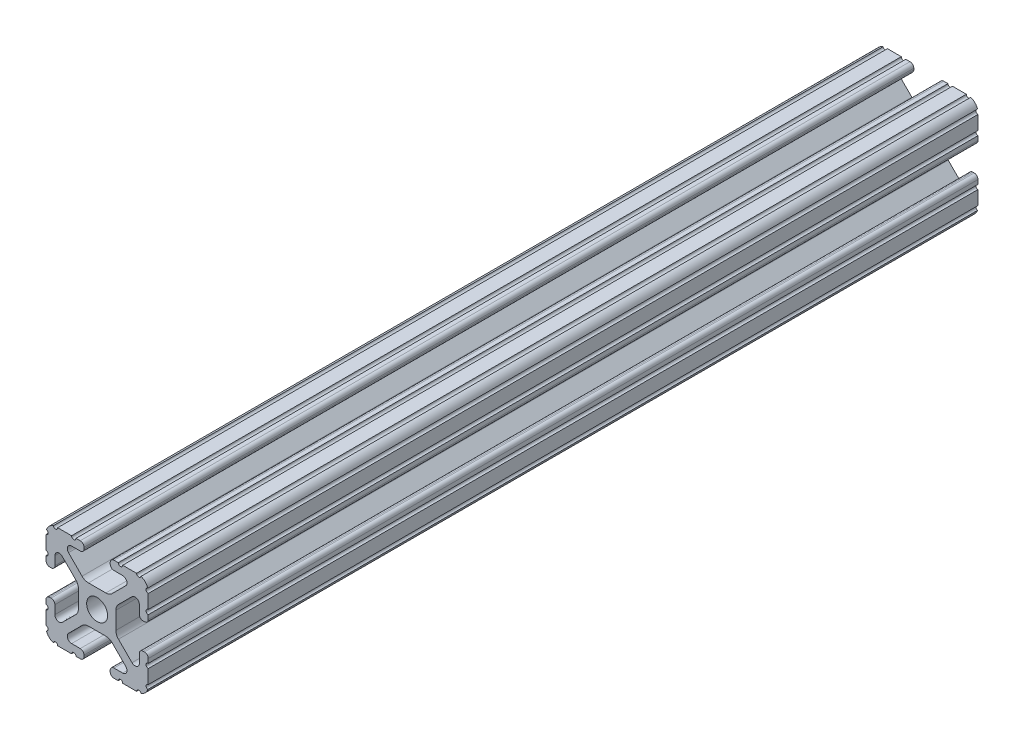
from build123d import *

# Parameters (mm, degrees)
BOSS_EXTRUDE1_START     = -103.060562
BOSS_EXTRUDE1_DEPTH     = 206.121124
CUT_EXTRUDE1_DEPTH      = 105.613858737
CUT_EXTRUDE1_DEPTH_BACK = 105.613858737
SKETCH5_R               = 0.55245


with BuildPart() as part:
    # Sketch4 → Boss-Extrude1 (new body)
    with BuildSketch(Plane.XY.offset(BOSS_EXTRUDE1_START)):
        with BuildLine():
            Line((4.190365, -12.7), (10.11729625, -12.7))
            ThreePointArc((10.11729625, -12.7), (11.943543585, -11.943543585), (12.7, -10.11729625))
            Line((12.7, -10.11729625), (12.7, -4.190365))
            ThreePointArc((12.7, -4.190365), (12.42492494, -3.52627506), (11.760835, -3.2512))
            Line((11.760835, -3.2512), (11.429365, -3.2512))
            ThreePointArc((11.429365, -3.2512), (10.76527506, -3.52627506), (10.4902, -4.190365))
            Line((10.4902, -4.190365), (10.4902, -6.348478019))
            ThreePointArc((10.4902, -6.348478019), (9.830707141, -7.335478831), (8.666460301, -7.103895736))
            Line((8.666460301, -7.103895736), (5.299899128, -3.737334563))
            ThreePointArc((5.299899128, -3.737334563), (4.817571085, -3.015479634), (4.6482, -2.16399369))
            Line((4.6482, -2.16399369), (4.6482, 0))
            Line((4.6482, 0), (2.6035, 0))
            ThreePointArc((2.6035, 0), (1.840952505, -1.840952505), (0, -2.6035))
            Line((0, -2.6035), (0, -4.6482))
            Line((0, -4.6482), (2.16399369, -4.6482))
            ThreePointArc((2.16399369, -4.6482), (3.015479634, -4.817571085), (3.737334563, -5.299899128))
            Line((3.737334563, -5.299899128), (7.103895736, -8.666460301))
            ThreePointArc((7.103895736, -8.666460301), (7.335478831, -9.830707141), (6.348478019, -10.4902))
            Line((6.348478019, -10.4902), (4.190365, -10.4902))
            ThreePointArc((4.190365, -10.4902), (3.52627506, -10.76527506), (3.2512, -11.429365))
            Line((3.2512, -11.429365), (3.2512, -11.760835))
            ThreePointArc((3.2512, -11.760835), (3.52627506, -12.42492494), (4.190365, -12.7))
        make_face()
    extrude(amount=BOSS_EXTRUDE1_DEPTH)

    # Sketch5 → Cut-Extrude1 (cut, two sides: drawn at the far end of the back side and taken through both)
    with BuildSketch(Plane.XY.offset(-CUT_EXTRUDE1_DEPTH_BACK)):
        with Locations((10.356153152, -12.7)):
            Circle(SKETCH5_R)
        with Locations((5.796028019, -12.7)):
            Circle(SKETCH5_R)
        with Locations((12.7, -10.356153152)):
            Circle(SKETCH5_R)
        with Locations((12.7, -5.796028019)):
            Circle(SKETCH5_R)
    extrude(amount=CUT_EXTRUDE1_DEPTH + CUT_EXTRUDE1_DEPTH_BACK, mode=Mode.SUBTRACT)

    # Mirror1: part across plane


with BuildPart() as part_1:
    add(part.part)
    add(part.part.mirror(Plane(origin=(0, 0, 0), x_dir=(0, 0, 1), z_dir=(1, 0, 0))))

    # Mirror2: part across plane


with BuildPart() as part_2:
    add(part_1.part)
    add(part_1.part.mirror(Plane.ZX))


solid = part_2.part
